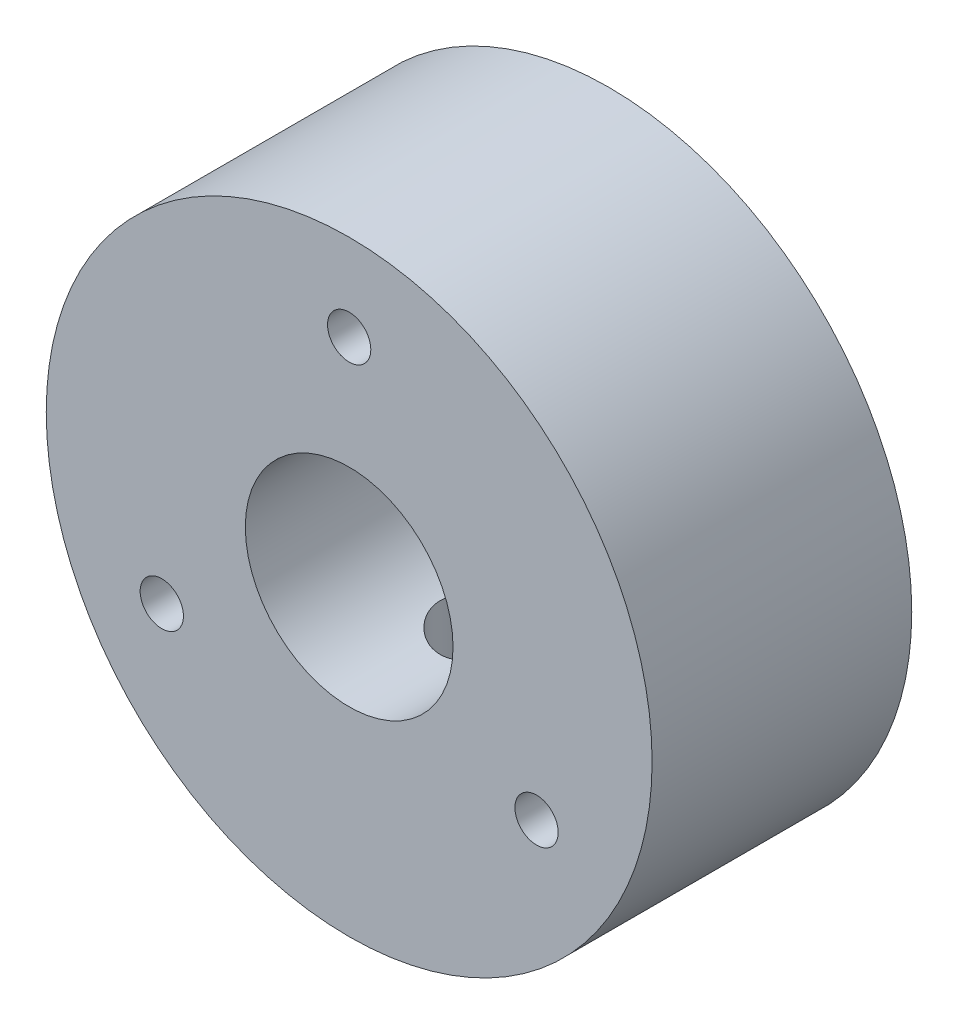
from build123d import *

# Parameters (mm, degrees)
SKETCH1_R           = 17.5
SKETCH1_R_2         = 6
BOSS_EXTRUDE1_DEPTH = 15
SKETCH2_R           = 2.25
CUT_EXTRUDE1_DEPTH  = 29.939592257
SKETCH3_R           = 1.25
CUT_EXTRUDE2_DEPTH  = 29.93959243


with BuildPart() as part:
    # Sketch1 → Boss-Extrude1 (new body)
    with BuildSketch(Plane.XY):
        Circle(SKETCH1_R)
        Circle(SKETCH1_R_2, mode=Mode.SUBTRACT)
    extrude(amount=BOSS_EXTRUDE1_DEPTH)

    # Sketch2 → Cut-Extrude1 (cut, through all)
    with BuildSketch(Plane(origin=(0, 0, 0), x_dir=(1, 0, 0), z_dir=(0, 1, 0))):
        with Locations(Location((0, -7.5, 0), (0, 0, 270))):
            Circle(SKETCH2_R)
    extrude(amount=-CUT_EXTRUDE1_DEPTH, mode=Mode.SUBTRACT)

    # Sketch3 → Cut-Extrude2 (cut, through all)
    with BuildSketch(Plane.XY.offset(15)):
        with Locations((0, 12.5)):
            Circle(SKETCH3_R)
        with Locations((10.825317547, -6.25)):
            Circle(SKETCH3_R)
        with Locations((-10.825317547, -6.25)):
            Circle(SKETCH3_R)
    extrude(amount=-CUT_EXTRUDE2_DEPTH, mode=Mode.SUBTRACT)


solid = part.part
